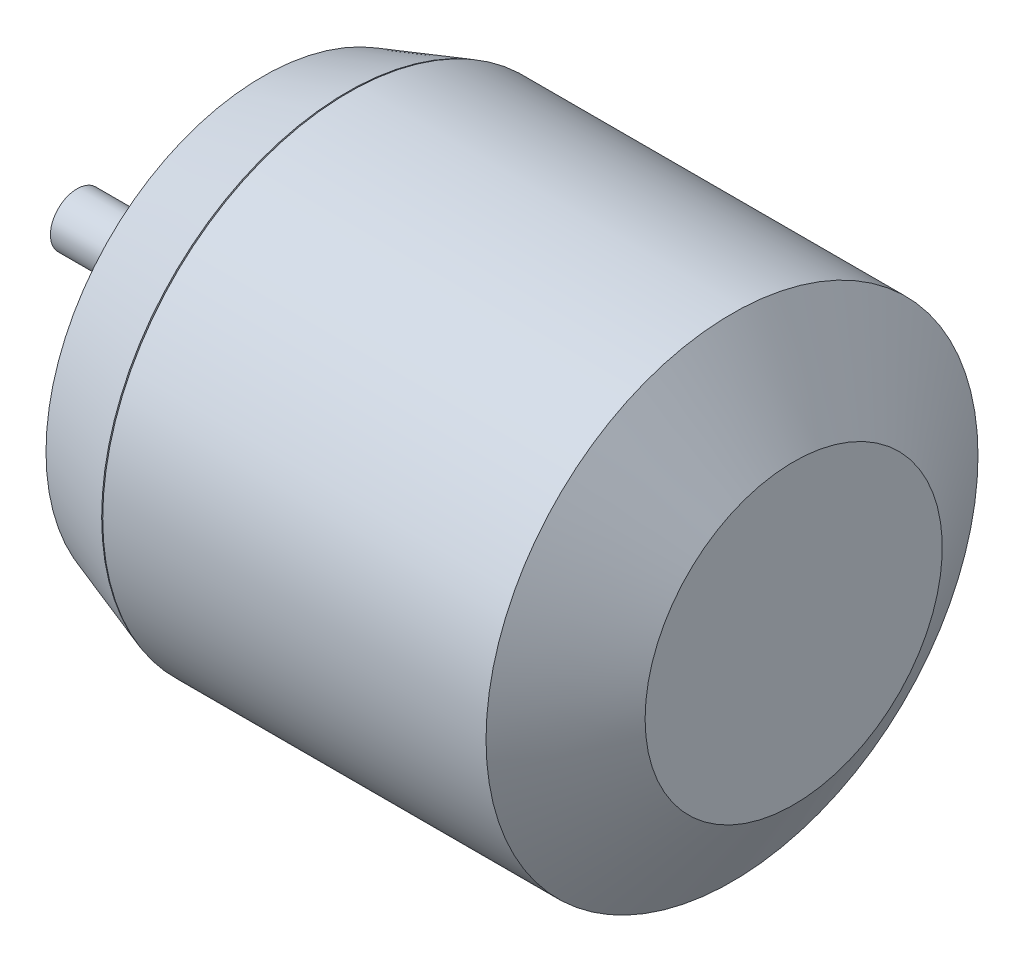
from build123d import *

# Parameters (mm, degrees)
SKETCH2_R          = 1.5
CUT_EXTRUDE1_DEPTH = 10


with BuildPart() as part:
    # Sketch1 → Revolve2 (revolve)
    with BuildSketch(Plane.XY, mode=Mode.PRIVATE) as revolve2_sk:
        Polygon((-25.236130379, 13.869097433), (-30, 12.25), (-30, 1.5), (-40.5, 1.5), (-40.5, 0), (0, 0), (0, 8.396394587), (-3.485025076, 13.9), (-25.145205772, 13.9), (-25.145205772, 6.9), (-25.236130379, 6.858374097), align=None)
    revolve(revolve2_sk.sketch.rotate(Axis((-72.504474406, 0, 0), (1, 0, 0)), 90), axis=Axis((-72.504474406, 0, 0), (1, 0, 0)))

    # Sketch2 → Cut-Extrude1 (cut)
    with BuildSketch(Plane.ZY.offset(30)):
        with Locations((5.918430072, 7.431163131)):
            Circle(SKETCH2_R)
        with Locations((-6.257821584, 4.983941113)):
            Circle(SKETCH2_R)
        with Locations(Location((6.257821584, -4.983941113, 0), (0, 0, 180))):
            Circle(SKETCH2_R)
        with Locations((-5.918430072, -7.431163131)):
            Circle(SKETCH2_R)
    extrude(amount=-CUT_EXTRUDE1_DEPTH, mode=Mode.SUBTRACT)


solid = part.part
